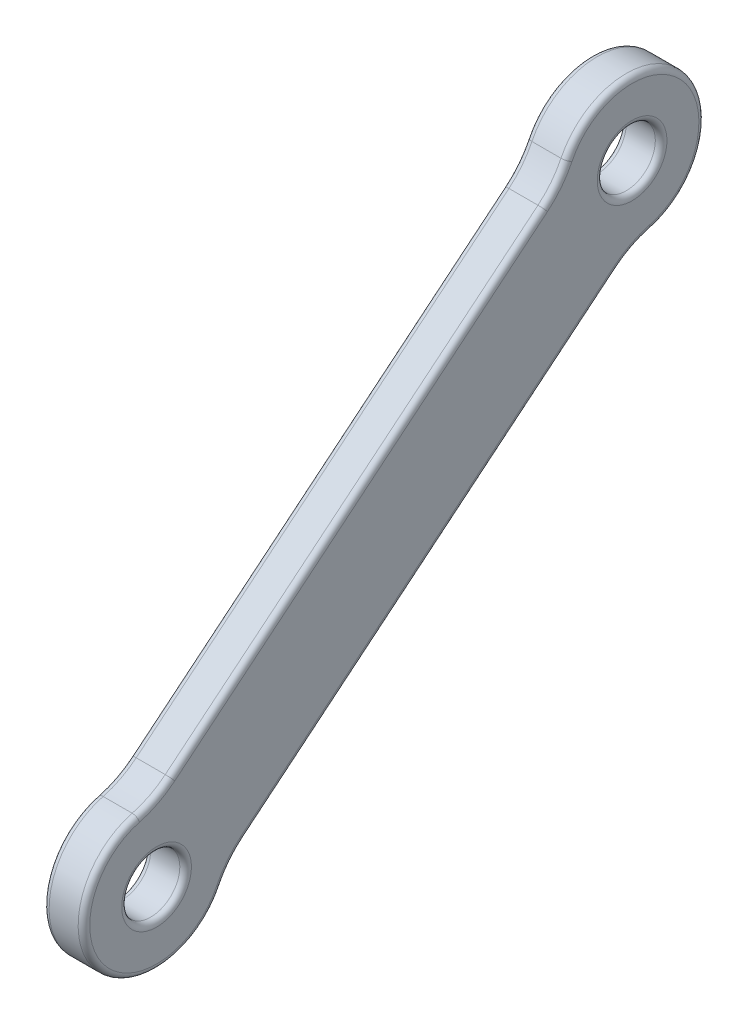
from build123d import *

# Parameters (mm, degrees)
SKETCH2_R           = 5
BOSS_EXTRUDE1_DEPTH = 7
FILLET1_R           = 1


with BuildPart() as part:
    # Sketch2 → Boss-Extrude1 (new body)
    with BuildSketch(Plane.YZ):
        with BuildLine():
            Line((67.792672883, -66.653119845), (15.001173208, -2.492950539))
            ThreePointArc((15.001173208, -2.492950539), (13.235549048, 0.195688878), (12.083739226, 3.198944565))
            ThreePointArc((12.083739226, 3.198944565), (-7.942190484, 9.65254424), (-5.466341212, -11.24140177))
            ThreePointArc((-5.466341212, -11.24140177), (-2.741147099, -12.950064298), (-0.442897577, -15.200455313))
            Line((-0.442897577, -15.200455313), (52.348602098, -79.36062462))
            ThreePointArc((52.348602098, -79.36062462), (54.114226258, -82.049264037), (55.26603608, -85.052519723))
            ThreePointArc((55.26603608, -85.052519723), (75.29196579, -91.506119399), (72.816116517, -70.612173388))
            ThreePointArc((72.816116517, -70.612173388), (70.090922405, -68.903510861), (67.792672883, -66.653119845))
        make_face()
        with Locations(Location((0, 0, 0), (0, 0, 270))):
            Circle(SKETCH2_R, mode=Mode.SUBTRACT)
        with Locations(Location((67.349775306, -81.853575159, 0), (0, 0, 270))):
            Circle(SKETCH2_R, mode=Mode.SUBTRACT)
    extrude(amount=BOSS_EXTRUDE1_DEPTH)

    # Fillet1
    fillet1_edges = [part.edges().sort_by_distance(p)[0] for p in [
        (0, -7.942190484, 9.65254424),
        (0, 13.235549048, 0.195688878),
        (0, 41.396923045, -34.573035192),
        (0, 70.090922405, -68.903510861),
        (7, 13.235549048, 0.195688878),
        (7, -7.942190484, 9.65254424),
        (7, -2.741147099, -12.950064298),
        (0, 0, 5),
        (7, 0, 5),
        (7, 25.952852261, -47.280539967),
        (0, 67.349775306, -76.853575159),
        (7, 67.349775306, -76.853575159),
        (7, 54.114226258, -82.049264037),
        (7, 75.29196579, -91.506119399),
        (7, 70.090922405, -68.903510861),
        (0, 75.29196579, -91.506119399),
        (7, 41.396923045, -34.573035192),
        (0, 54.114226258, -82.049264037),
        (0, 25.952852261, -47.280539967),
        (0, -2.741147099, -12.950064298),
    ]]
    fillet(fillet1_edges, radius=FILLET1_R)


solid = part.part
